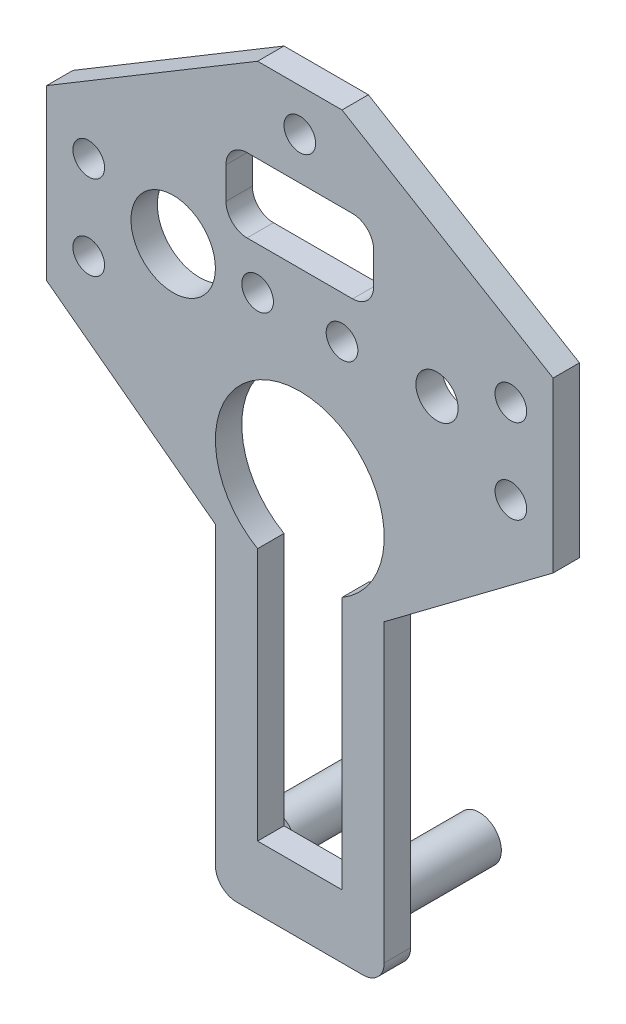
from build123d import *

# Parameters (mm, degrees)
SKETCH1_R           = 4
SKETCH1_R_2         = 1.5
SKETCH1_R_3         = 2
BOSS_EXTRUDE1_DEPTH = 2.5
SKETCH2_R           = 2.1
BOSS_EXTRUDE2_DEPTH = 9.5


with BuildPart() as part:
    # Sketch1 → Boss-Extrude1 (new body)
    with BuildSketch(Plane.XY):
        with BuildLine():
            Line((-24, 5.07179677), (-24, 21.07179677))
            Line((-24, 21.07179677), (-4, 33.07179677))
            Line((-4, 33.07179677), (4, 33.07179677))
            Line((4, 33.07179677), (24, 21.07179677))
            Line((24, 21.07179677), (24, 5.07179677))
            Line((24, 5.07179677), (8, -6.92820323))
            Line((8, -6.92820323), (8, -34.92820323))
            ThreePointArc((8, -34.92820323), (7.414213562, -36.342416793), (6, -36.92820323))
            Line((6, -36.92820323), (-6, -36.92820323))
            ThreePointArc((-6, -36.92820323), (-7.414213562, -36.342416793), (-8, -34.92820323))
            Line((-8, -34.92820323), (-8, -6.92820323))
            Line((-8, -6.92820323), (-24, 5.07179677))
        make_face()
        with Locations((-12, 14.07179677)):
            Circle(SKETCH1_R, mode=Mode.SUBTRACT)
        with Locations((-4, 14.07179677)):
            Circle(SKETCH1_R_2, mode=Mode.SUBTRACT)
        with Locations((4, 14.07179677)):
            Circle(SKETCH1_R_2, mode=Mode.SUBTRACT)
        with Locations((0, 29.07179677)):
            Circle(SKETCH1_R_2, mode=Mode.SUBTRACT)
        with Locations((20, 17.07179677)):
            Circle(SKETCH1_R_2, mode=Mode.SUBTRACT)
        with Locations((20, 9.07179677)):
            Circle(SKETCH1_R_2, mode=Mode.SUBTRACT)
        with Locations((-20, 17.07179677)):
            Circle(SKETCH1_R_2, mode=Mode.SUBTRACT)
        with Locations((-20, 9.07179677)):
            Circle(SKETCH1_R_2, mode=Mode.SUBTRACT)
        with Locations((13, 14.07179677)):
            Circle(SKETCH1_R_3, mode=Mode.SUBTRACT)
        with BuildLine():
            Line((4, -30.92820323), (-4, -30.92820323))
            Line((-4, -30.92820323), (-4, -6.92820323))
            ThreePointArc((-4, -6.92820323), (0, 8), (4, -6.92820323))
            Line((4, -6.92820323), (4, -30.92820323))
        make_face(mode=Mode.SUBTRACT)
        with BuildLine():
            Line((-5, 25.07179677), (5, 25.07179677))
            ThreePointArc((5, 25.07179677), (6.414213562, 24.486010332), (7, 23.07179677))
            Line((7, 23.07179677), (7, 20.07179677))
            ThreePointArc((7, 20.07179677), (6.414213562, 18.657583207), (5, 18.07179677))
            Line((5, 18.07179677), (-5, 18.07179677))
            ThreePointArc((-5, 18.07179677), (-6.414213562, 18.657583207), (-7, 20.07179677))
            Line((-7, 20.07179677), (-7, 23.07179677))
            ThreePointArc((-7, 23.07179677), (-6.414213562, 24.486010332), (-5, 25.07179677))
        make_face(mode=Mode.SUBTRACT)
    extrude(amount=BOSS_EXTRUDE1_DEPTH)

    # Sketch2 → Boss-Extrude2 (add)
    with BuildSketch(Plane(origin=(0, 0, 0), x_dir=(-1, 0, 0), z_dir=(0, 0, -1))):
        with Locations(Location((-5, -32.16164975, 0), (0, 0, 61.563109851))):
            Circle(SKETCH2_R)
        with Locations(Location((5, -32.16164975, 0), (0, 0, 144.030430851))):
            Circle(SKETCH2_R)
    extrude(amount=BOSS_EXTRUDE2_DEPTH)


solid = part.part
